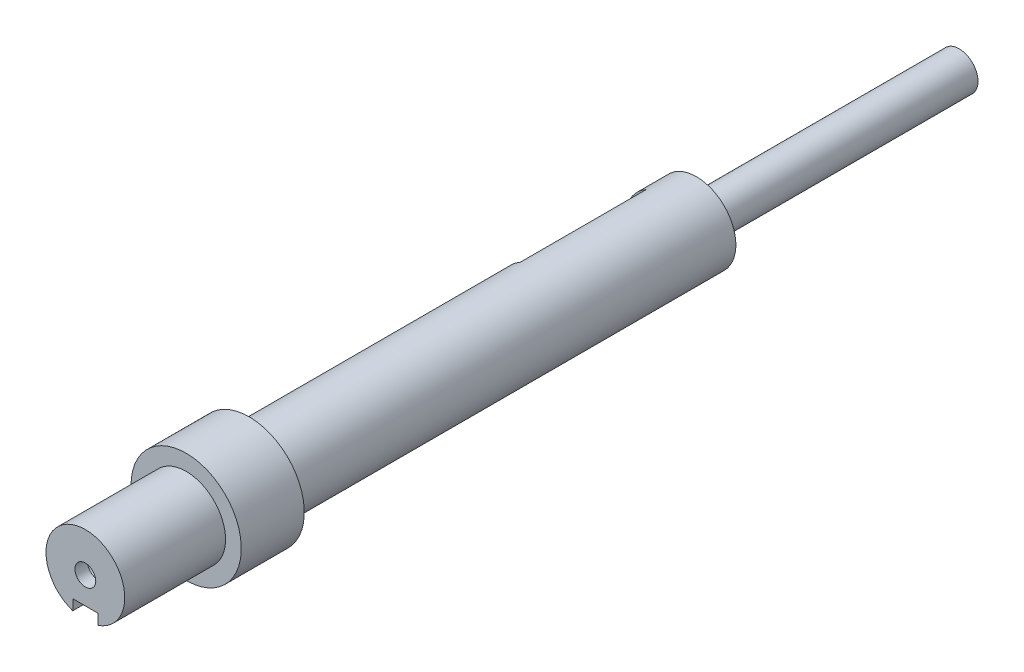
from build123d import *
from build123d.topology import SkipClean

# Parameters (mm, degrees)
ESQUISSE1_R                                = 30
BOSS_EXTRU_1_DEPTH                         = 15
ESQUISSE2_R                                = 12.5
BOSS_EXTRU_2_DEPTH                         = 184
ESQUISSE4_2_W                              = 230
ESQUISSE4_2_H                              = 40
ENL_V_MAT_EXTRU_1_DEPTH                    = 5
CHAMBRAGE_POUR_VIS_T_TE_HEXAGONALE_2_COUNT = 2
CHAMBRAGE_POUR_VIS_T_TE_HEXAGONALE_2_PITCH = 41
ESQUISSE17_R                               = 6
BOSS_EXTRU_4_DEPTH                         = 83.38
ESQUISSE18_W                               = 10.356322474
ESQUISSE18_H                               = 3
ENL_V_MAT_EXTRU_2_DEPTH                    = 3
ESQUISSE19_W                               = 7.933443835
ESQUISSE19_H                               = 21.9317122
ENL_V_MAT_EXTRU_3_DEPTH                    = 50
BOSS_EXTRU_6_START                         = -10
ESQUISSE21_R                               = 12.5
BOSS_EXTRU_6_DEPTH                         = 10
ESQUISSE26_R                               = 17.5
BOSS_EXTRU_8_DEPTH                         = 112
ENL_V_START                                = -92
ESQUISSE27_R                               = 17.5
ENL_V_MAT_EXTRU_5_DEPTH                    = 92
ENL_V_START_2                              = -15
ESQUISSE28_R                               = 30
ENL_V_MAT_EXTRU_6_DEPTH                    = 15
BOSS_EXTRU_9_START                         = 10
BOSS_EXTRU_9_DEPTH                         = 10
D_GAGEMENT_M61_D                           = 6.6
D_GAGEMENT_M61_DEPTH                       = 4
D_GAGEMENT_M61_TIP                         = 1.905255888


with BuildPart() as part:
    # Esquisse1 → Boss.-Extru.1 (new body)
    with BuildSketch(Plane.XY):
        Circle(ESQUISSE1_R)
    extrude(amount=BOSS_EXTRU_1_DEPTH)

    # Esquisse2 → Boss.-Extru.2 (add)
    with BuildSketch(Plane(origin=(0, 0, 0), x_dir=(-1, 0, 0), z_dir=(0, 0, -1))):
        Circle(ESQUISSE2_R)
    extrude(amount=BOSS_EXTRU_2_DEPTH)

    # Esquisse4<2> → Enlèv. mat.-Extru.1 (cut)
    with BuildSketch(Plane.XY.offset(15)):
        Rectangle(ESQUISSE4_2_W, ESQUISSE4_2_H)
    extrude(amount=-ENL_V_MAT_EXTRU_1_DEPTH, mode=Mode.SUBTRACT)

    # Esquisse14 → Chambrage pour vis à tête hexagonale M51 (revolve, cut)
    with BuildSketch(Plane.YZ.offset(-20.5)):
        Polygon((0, 0), (0, 15), (2.75, 15), (2.75, 3.605), (2.775, 3.58), (6.12, 3.58), (6.12, 0), align=None)
    chambrage_pour_vis_t_te_hexagonale_m51 = revolve(axis=Axis((-20.5, 0, -6.35), (0, 0, 1)), mode=Mode.SUBTRACT)

    # Chambrage pour vis _ t_te hexagonale 2: Chambrage pour vis à tête hexagonale M51 ×2
    with Locations(*[(i * CHAMBRAGE_POUR_VIS_T_TE_HEXAGONALE_2_PITCH, 0, 0) for i in range(1, CHAMBRAGE_POUR_VIS_T_TE_HEXAGONALE_2_COUNT)]):
        add(chambrage_pour_vis_t_te_hexagonale_m51, mode=Mode.SUBTRACT)

    # Esquisse17 → Boss.-Extru.4 (add)
    with BuildSketch(Plane(origin=(0, 0, -184), x_dir=(-1, 0, 0), z_dir=(0, 0, -1))):
        Circle(ESQUISSE17_R)
    extrude(amount=BOSS_EXTRU_4_DEPTH)

    # Esquisse18 → Enlèv. mat.-Extru.2 (cut)
    with BuildSketch(Plane(origin=(0, 0, -267.38), x_dir=(-1, 0, 0), z_dir=(0, 0, -1))):
        with Locations((1.787207702, 0)):
            Rectangle(ESQUISSE18_W, ESQUISSE18_H)
    extrude(amount=-ENL_V_MAT_EXTRU_2_DEPTH, mode=Mode.SUBTRACT)

    # Esquisse19 → Enlèv. mat.-Extru.3 (cut)
    with BuildSketch(Plane(origin=(0, 0, -184), x_dir=(-1, 0, 0), z_dir=(0, 0, -1))):
        with Locations((9.966721917, 0)):
            Rectangle(ESQUISSE19_W, ESQUISSE19_H)
    extrude(amount=-ENL_V_MAT_EXTRU_3_DEPTH, mode=Mode.SUBTRACT)

    # Esquisse21 → Boss.-Extru.6 (add)
    with BuildSketch(Plane(origin=(0, 0, -184), x_dir=(-1, 0, 0), z_dir=(0, 0, -1)).offset(BOSS_EXTRU_6_START)):
        Circle(ESQUISSE21_R)
    extrude(amount=BOSS_EXTRU_6_DEPTH)

    # Esquisse26 → Boss.-Extru.8 (add)
    with BuildSketch(Plane(origin=(0, 0, -134), x_dir=(-1, 0, 0), z_dir=(0, 0, -1))):
        Circle(ESQUISSE26_R)
    extrude(amount=-BOSS_EXTRU_8_DEPTH)

    # Esquisse27 → Enlèv. mat.-Extru.5 (cut)
    with BuildSketch(Plane(origin=(0, 0, -134), x_dir=(-1, 0, 0), z_dir=(0, 0, -1)).offset(ENL_V_START)):
        Circle(ESQUISSE27_R)
        with BuildLine():
            ThreePointArc((6, 10.9658561), (10.752906584, 6.373774392), (12.5, 0))
            ThreePointArc((12.5, 0), (10.752906584, -6.373774392), (6, -10.9658561))
            ThreePointArc((6, -10.9658561), (-12.5, 0), (6, 10.9658561))
        make_face(mode=Mode.SUBTRACT)
    extrude(amount=ENL_V_MAT_EXTRU_5_DEPTH, mode=Mode.SUBTRACT)

    # Esquisse28 → Enlèv. mat.-Extru.6 (cut)
    with BuildSketch(Plane.XY.offset(15).offset(ENL_V_START_2)):
        Circle(ESQUISSE28_R)
    extrude(amount=ENL_V_MAT_EXTRU_6_DEPTH, mode=Mode.SUBTRACT)

    # Esquisse29 → Boss.-Extru.9 (add)
    with SkipClean():  # the faces are left unmerged after this step: merging them gives an invalid solid
        with BuildSketch(Plane.XY.offset(BOSS_EXTRU_9_START)):
            with BuildLine():
                Line((-4, -11.842719282), (-4, -8.5))
                Line((-4, -8.5), (4, -8.5))
                Line((4, -8.5), (4, -11.842719282))
                ThreePointArc((4, -11.842719282), (10.155048006, -7.288689869), (12.5, 0))
                ThreePointArc((12.5, 0), (-7.288689869, 10.155048006), (-4, -11.842719282))
            make_face()
        extrude(amount=-BOSS_EXTRU_9_DEPTH)

    # Dégagement M61
    with Locations(Plane.XY.offset(10)):
        with Locations((0, 0)):
            Hole(D_GAGEMENT_M61_D / 2, depth=D_GAGEMENT_M61_DEPTH)
            with Locations((0, 0, -(D_GAGEMENT_M61_DEPTH + D_GAGEMENT_M61_TIP / 2))):  # 120° drill point
                Cone(0, D_GAGEMENT_M61_D / 2, D_GAGEMENT_M61_TIP, mode=Mode.SUBTRACT)


solid = part.part
